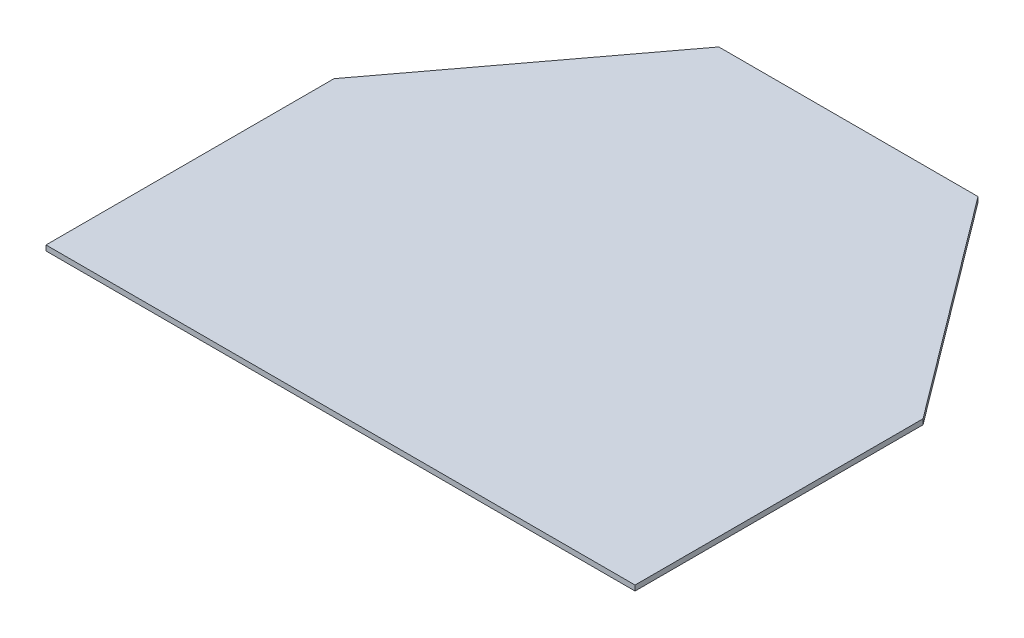
from build123d import *

# Parameters (mm, degrees)
EXTRUDE_1_DEPTH = 4


with BuildPart() as part:
    # 草图1 → 凸台-拉伸1 (new body)
    with BuildSketch(Plane(origin=(0, 0, 0), x_dir=(1, 0, 0), z_dir=(0, 1, 0))):
        Polygon((-225, 0), (225, 0), (225, 220), (99, 388), (-99, 388), (-225, 220), align=None)
    extrude(amount=EXTRUDE_1_DEPTH)


solid = part.part
